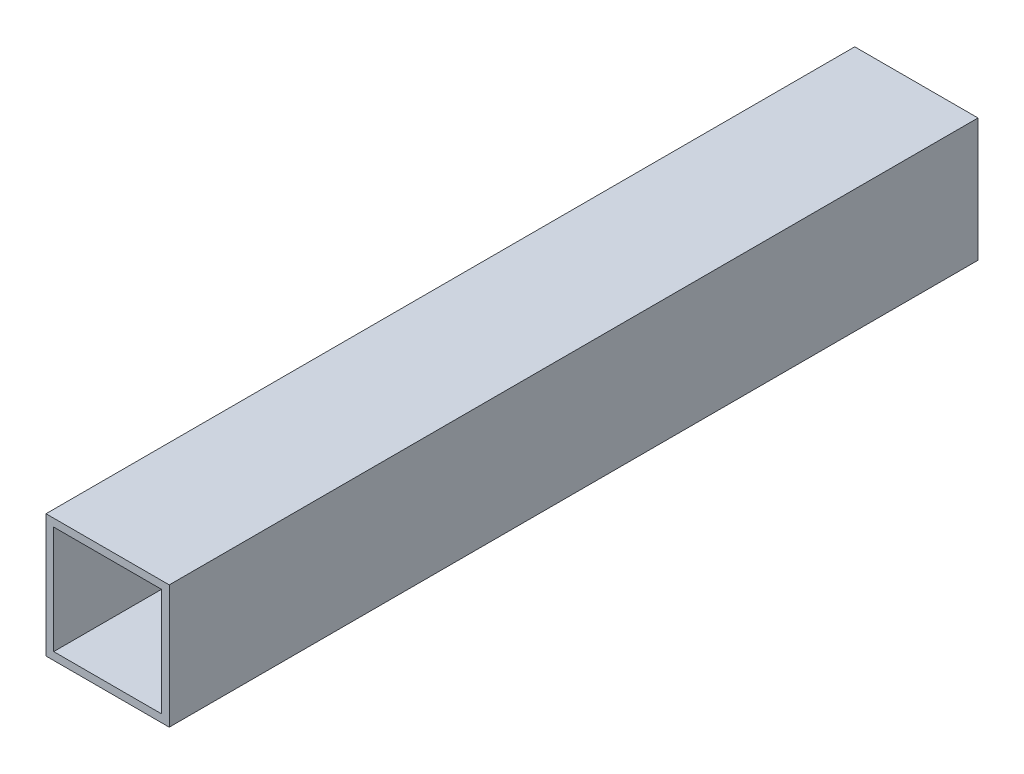
from build123d import *

# Parameters (mm, degrees)
CROQUIS1_W              = 76.2
CROQUIS1_H              = 76.2
CROQUIS1_W_2            = 66.675
CROQUIS1_H_2            = 66.675
SALIENTE_EXTRUIR1_DEPTH = 500


with BuildPart() as part:
    # Croquis1 → Saliente-Extruir1 (new body)
    with BuildSketch(Plane.XY):
        with Locations((38.1, -38.1)):
            Rectangle(CROQUIS1_W, CROQUIS1_H)
        with Locations((38.1, -38.1)):
            Rectangle(CROQUIS1_W_2, CROQUIS1_H_2, mode=Mode.SUBTRACT)
    extrude(amount=SALIENTE_EXTRUIR1_DEPTH)


solid = part.part
